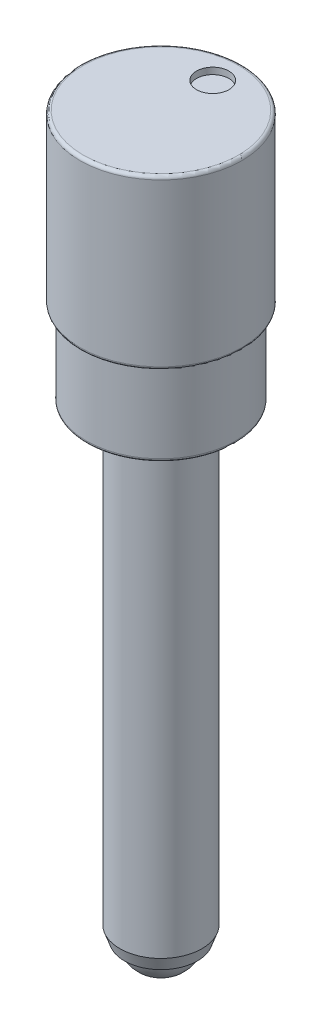
from build123d import *

# Parameters (mm, degrees)
SKETCH1_R                    = 6.25
TOP_HEAD_WITH_KNURLING_DEPTH = 13
SKETCH2_R                    = 5.75
FLAT_BOTTOM_OF_HEAD_DEPTH    = 6.5
FILLET1_R                    = 0.25
SKETCH3_R                    = 3.175
SCREW_PIECE_DEPTH            = 35
SKETCH4_R                    = 3.175
DRAFTED_SCREW_END_DEPTH      = 1
DRAFTED_SCREW_END_TAPER      = 19.5
SKETCH6_R                    = 2.5
CUT_EXTRUDE1_DEPTH           = 0.5
REVOLVE3_ANGLE               = 180
SKETCH8_R                    = 1.25
CUT_EXTRUDE2_DEPTH           = 0.5
BOSS_EXTRUDE1_REACH          = 57.706
BOSS_EXTRUDE1_END_RADIUS     = 2.51
SKETCH10_R                   = 0.076631062


with BuildPart() as part:
    # Sketch1 → top head with knurling (new body)
    with BuildSketch(Plane(origin=(0, 0, 0), x_dir=(1, 0, 0), z_dir=(0, 1, 0))):
        with Locations(Location((0, 0, 0), (0, 0, 90))):
            Circle(SKETCH1_R)
    extrude(amount=TOP_HEAD_WITH_KNURLING_DEPTH)

    # Sketch2 → flat bottom of head (add)
    with BuildSketch(Plane.XZ):
        with Locations(Location((0, 0, 0), (0, 0, 90))):
            Circle(SKETCH2_R)
    extrude(amount=FLAT_BOTTOM_OF_HEAD_DEPTH)

    # Fillet1
    fillet1_edges = [part.edges().sort_by_distance(p)[0] for p in [
        (0, 0, 6.25),
        (0, 13, 6.25),
        (0, -6.5, -5.75),
    ]]
    fillet(fillet1_edges, radius=FILLET1_R)

    # Sketch8 → Cut-Extrude2 (cut)
    with BuildSketch(Plane(origin=(0, 13, 0), x_dir=(1, 0, 0), z_dir=(0, 1, 0))):
        with Locations(Location((0, 4, 0), (0, 0, 270))):
            Circle(SKETCH8_R)
    extrude(amount=-CUT_EXTRUDE2_DEPTH, mode=Mode.SUBTRACT)


with BuildPart() as body_2:
    # Sketch3 → screw piece (new body)
    with BuildSketch(Plane.XZ.offset(6.5)):
        with Locations(Location((0, 0, 0), (0, 0, 270))):
            Circle(SKETCH3_R)
    extrude(amount=SCREW_PIECE_DEPTH)


with BuildPart() as body_3:
    # Sketch4 → drafted screw end (new body)
    with BuildSketch(Plane(origin=(0, -41.5, 0), x_dir=(-1, 0, 0), z_dir=(0, -1, 0))):
        with Locations(Location((0, 0, 0), (0, 0, 90))):
            Circle(SKETCH4_R)
    extrude(amount=DRAFTED_SCREW_END_DEPTH, taper=DRAFTED_SCREW_END_TAPER)

    # Sketch6 → Cut-Extrude1 (cut)
    with BuildSketch(Plane.XZ.offset(42.5)):
        with Locations(Location((0, 0, 0), (0, 0, 270))):
            Circle(SKETCH6_R)
    extrude(amount=-CUT_EXTRUDE1_DEPTH, mode=Mode.SUBTRACT)



with BuildPart() as body_4:
    # Sketch7 → Revolve3 (revolve)
    with BuildSketch(Plane(origin=(0, -42, 0), x_dir=(-1, 0, 0), z_dir=(0, -1, 0))):
        with BuildLine():
            Line((2.5, 0), (-2.5, 0))
            ThreePointArc((-2.5, 0), (0, -2.5), (2.5, 0))
        make_face()
    revolve(axis=Axis((-2.5, -42, 0), (1, 0, 0)), revolution_arc=REVOLVE3_ANGLE)


with BuildPart() as body_3_1:
    add(body_3.part)

    add(body_4.part)  # Boss-Extrude1 merges body 4
    # Boss-Extrude1: up to this sphere (the profile starts inside it)
    boss_extrude1_end = Location((0, -42, 0)) * Sphere(BOSS_EXTRUDE1_END_RADIUS, mode=Mode.PRIVATE)
    # Sketch10 → Boss-Extrude1 (add, up to the surface)
    with BuildSketch(Plane.XZ.offset(42), mode=Mode.PRIVATE) as boss_extrude1_sk1:
        with Locations(Location((0, 0, 0), (0, 0, 90))):
            Circle(SKETCH10_R)
    boss_extrude1_tool1 = extrude(boss_extrude1_sk1.sketch, amount=BOSS_EXTRUDE1_REACH, mode=Mode.PRIVATE) & boss_extrude1_end
    add(boss_extrude1_tool1.solids().sort_by_distance((0, -42, 0))[0])


solid = Compound([part.part, body_2.part, body_3_1.part])
